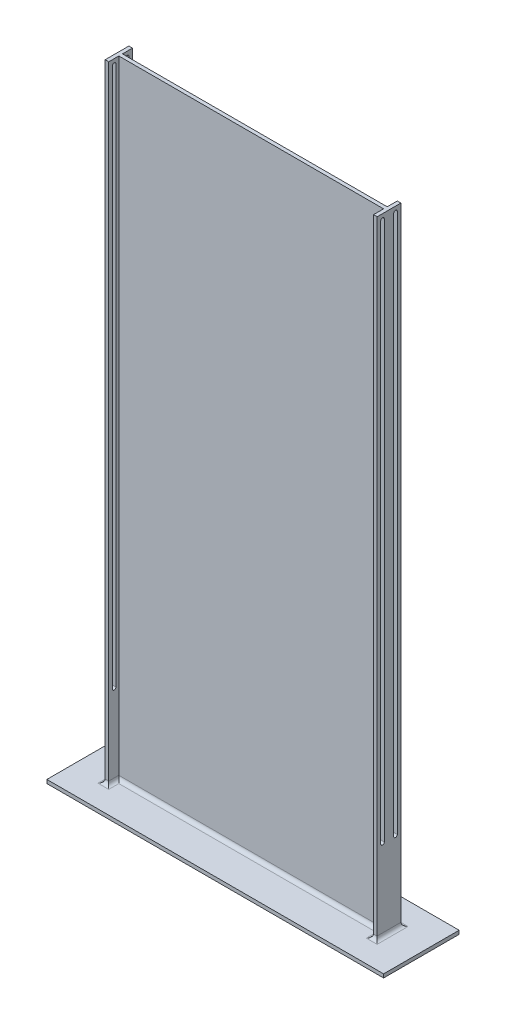
from build123d import *

# Parameters (mm, degrees)
WALL_EXTRUDE_DEPTH           = 368
RIGHT_GUIDE_EXTRUDE_DEPTH    = 10
SKETCH3_W                    = 936
SKETCH3_H                    = 210
BOTTOM_FOOT_COMPLETION_DEPTH = 10
SKETCH4_W                    = 736
SKETCH4_H                    = 10
PLATFORM_STOPPER_DEPTH       = 28
STRUCTURAL_FILLETS_R         = 10


with BuildPart() as part:
    # Sketch1 → Wall extrude (new, symmetric)
    with BuildSketch(Plane(origin=(0, 0, 0), x_dir=(0, 0, -1), z_dir=(1, 0, 0))):
        Polygon((0, 0), (-100, 0), (-100, -10), (10, -10), (110, -10), (110, 0), (10, 0), (10, 1741.5), (0, 1741.5), align=None)
    extrude(amount=WALL_EXTRUDE_DEPTH, both=True)

    # Sketch2 → Right guide extrude (add)
    with BuildSketch(Plane(origin=(368, 0, 0), x_dir=(0, 0, -1), z_dir=(1, 0, 0))):
        Polygon((0, 1741.5), (38, 1741.5), (38, -10), (0, -10), (-28, -10), (-28, 1741.5), align=None)
        with BuildLine():
            Line((18, 226.5), (18, 1726.5))
            ThreePointArc((18, 1726.5), (23, 1731.5), (28, 1726.5))
            Line((28, 1726.5), (28, 226.5))
            ThreePointArc((28, 226.5), (23, 221.5), (18, 226.5))
        make_face(mode=Mode.SUBTRACT)
        with BuildLine():
            Line((-18, 1726.5), (-18, 226.5))
            ThreePointArc((-18, 226.5), (-13, 221.5), (-8, 226.5))
            Line((-8, 226.5), (-8, 1726.5))
            ThreePointArc((-8, 1726.5), (-13, 1731.5), (-18, 1726.5))
        make_face(mode=Mode.SUBTRACT)
    right_guide_extrude = extrude(amount=RIGHT_GUIDE_EXTRUDE_DEPTH)

    # Left guide extrude: Right guide extrude across plane
    add(right_guide_extrude.mirror(Plane(origin=(0, 0, 0), x_dir=(0, 0, 1), z_dir=(1, 0, 0))))

    # Sketch3 → Bottom foot completion (add)
    with BuildSketch(Plane.XZ.offset(10)):
        with Locations((0, -5)):
            Rectangle(SKETCH3_W, SKETCH3_H)
    extrude(amount=-BOTTOM_FOOT_COMPLETION_DEPTH)

    # Sketch4 → Platform stopper (add)
    with BuildSketch(Plane(origin=(0, 0, -10), x_dir=(-1, 0, 0), z_dir=(0, 0, -1))):
        with Locations((0, 131.5)):
            Rectangle(SKETCH4_W, SKETCH4_H)
    extrude(amount=PLATFORM_STOPPER_DEPTH)

    # Structural fillets
    structural_fillets_edges = [part.edges().sort_by_distance(p)[0] for p in [
        (373, 0, 28),
        (373, 0, -38),
        (378, 0, -5),
        (-373, 0, -38),
        (-378, 0, -5),
        (-373, 0, 28),
        (-368, 0, 14),
        (-368, 126.5, -24),
        (368, 126.5, -24),
        (0, 126.5, -10),
        (0, 0, -10),
        (0, 0, 0),
        (368, 0, -24),
        (-368, 0, -24),
        (368, 0, 14),
    ]]
    fillet(structural_fillets_edges, radius=STRUCTURAL_FILLETS_R)


solid = part.part
